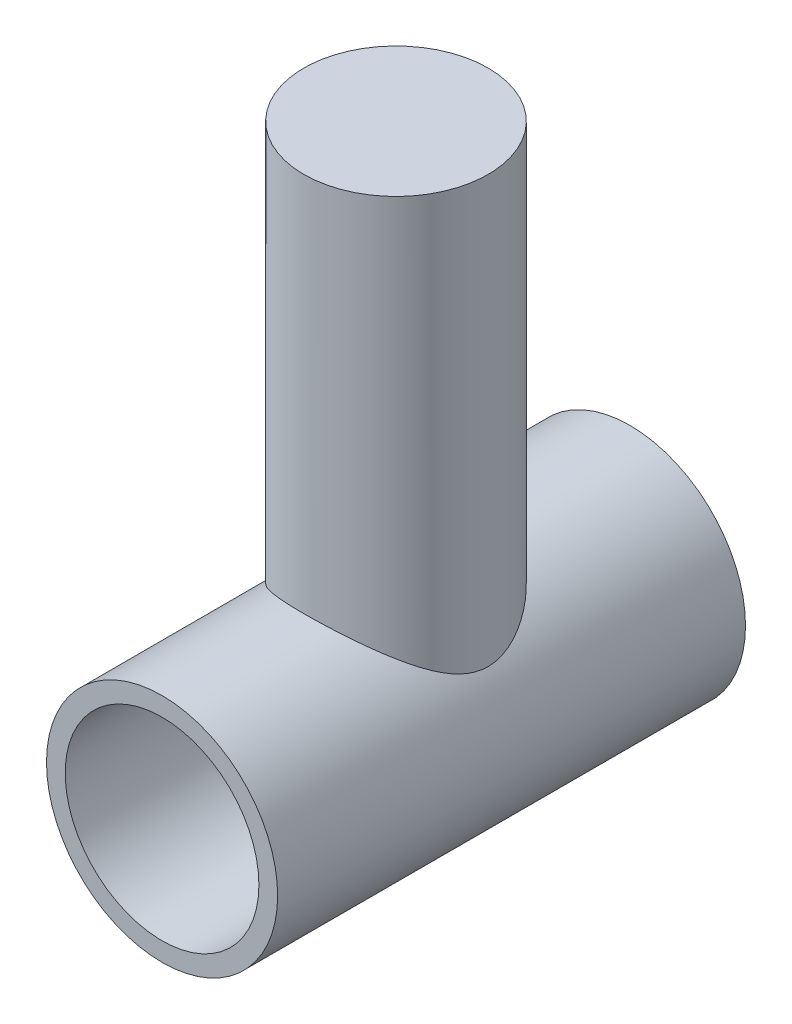
from build123d import *
from build123d.topology import SkipClean

# Parameters (mm, degrees)
SKETCH1_R           = 12.35
SKETCH1_R_2         = 10.35
BOSS_EXTRUDE1_DEPTH = 50
SKETCH2_R           = 9.85
BOSS_EXTRUDE2_DEPTH = 42
SKETCH2_3_R         = 9.85
BOSS_EXTRUDE3_DEPTH = 6
SKETCH1_2_R         = 10.35
CUT_EXTRUDE1_DEPTH  = 51


with BuildPart() as part:
    # Sketch1 → Boss-Extrude1 (new body)
    with BuildSketch(Plane.XY):
        Circle(SKETCH1_R)
        Circle(SKETCH1_R_2, mode=Mode.SUBTRACT)
    extrude(amount=BOSS_EXTRUDE1_DEPTH)



with BuildPart() as body_2:
    # Sketch2 → Boss-Extrude2 (new body)
    with BuildSketch(Plane(origin=(0, 11, 0), x_dir=(1, 0, 0), z_dir=(0, 1, 0))):
        with Locations((0, -25)):
            Circle(SKETCH2_R)
    extrude(amount=BOSS_EXTRUDE2_DEPTH)


with BuildPart() as part_1:
    with SkipClean():  # the faces are left unmerged after this step: merging them gives an invalid solid
        add(part.part)

        add(body_2.part)  # Boss-Extrude3 merges body 2
        # Sketch2<3> → Boss-Extrude3 (add)
        with BuildSketch(Plane(origin=(0, 11, 0), x_dir=(1, 0, 0), z_dir=(0, 1, 0))):
            with Locations((0, -25)):
                Circle(SKETCH2_3_R)
        extrude(amount=-BOSS_EXTRUDE3_DEPTH)

    # Sketch1<2> → Cut-Extrude1 (cut)
    with SkipClean():  # the faces are left unmerged after this step: merging them gives an invalid solid
        with BuildSketch(Plane.XY):
            Circle(SKETCH1_2_R)
        extrude(amount=CUT_EXTRUDE1_DEPTH, mode=Mode.SUBTRACT)


solid = part_1.part
